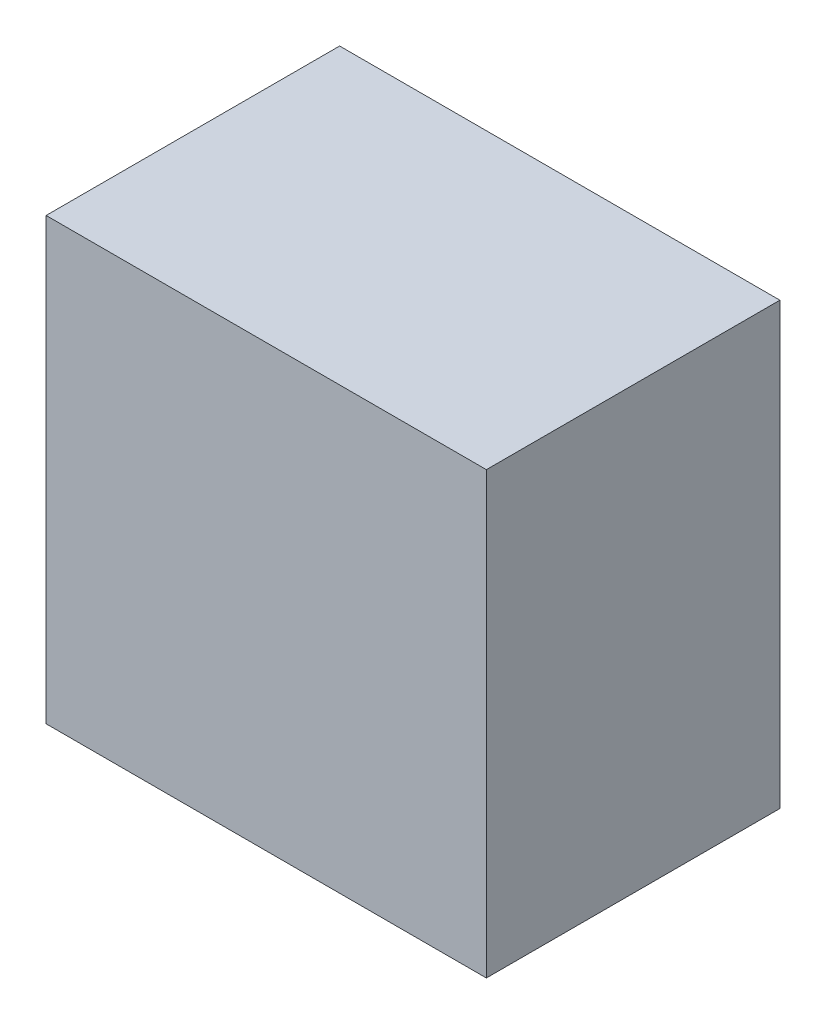
from build123d import *

# Parameters (mm, degrees)
SKETCH1_W           = 38.1
SKETCH1_H           = 25.4
BOSS_EXTRUDE1_DEPTH = 38.1


with BuildPart() as part:
    # Sketch1 → Boss-Extrude1 (new body)
    with BuildSketch(Plane(origin=(0, 0, 0), x_dir=(1, 0, 0), z_dir=(0, 1, 0))):
        with Locations((19.05, 12.7)):
            Rectangle(SKETCH1_W, SKETCH1_H)
    extrude(amount=BOSS_EXTRUDE1_DEPTH)


solid = part.part
